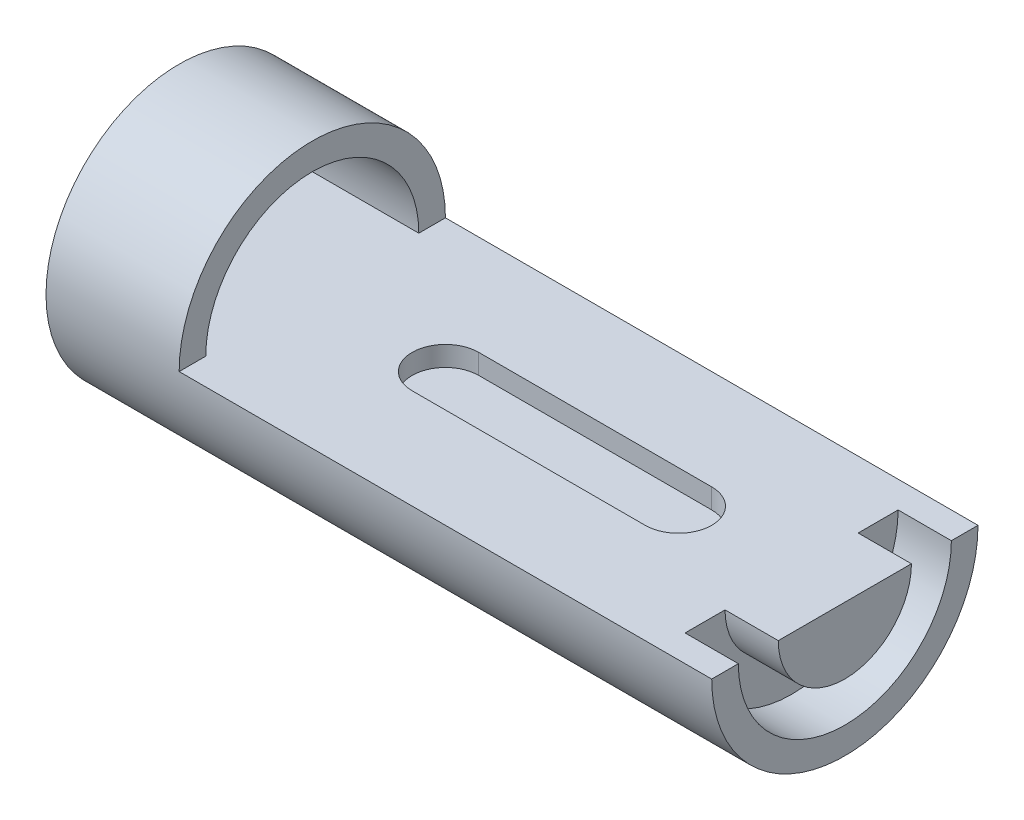
from build123d import *

# Parameters (mm, degrees)
SKETCH1_R           = 20
BOSS_EXTRUDE2_DEPTH = 20
BOSS_EXTRUDE3_START = 72
BOSS_EXTRUDE3_DEPTH = 72
BOSS_EXTRUDE4_START = 80
BOSS_EXTRUDE4_DEPTH = 80
CUT_EXTRUDE1_DEPTH  = 3


with BuildPart() as part:
    # Sketch1 → Boss-Extrude2 (new body)
    with BuildSketch(Plane(origin=(0, 0, 0), x_dir=(0, 0, -1), z_dir=(1, 0, 0))):
        Circle(SKETCH1_R)
        with BuildLine():
            ThreePointArc((-16, 0), (0, 16), (16, 0))
            Line((16, 0), (-16, 0))
        make_face(mode=Mode.SUBTRACT)
    extrude(amount=-BOSS_EXTRUDE2_DEPTH)

    # Sketch1<5> → Boss-Extrude3 (add)
    with BuildSketch(Plane(origin=(0, 0, 0), x_dir=(0, 0, -1), z_dir=(1, 0, 0)).offset(BOSS_EXTRUDE3_START)):
        with BuildLine():
            Line((16, 0), (10, 0))
            ThreePointArc((10, 0), (0, -10), (-10, 0))
            Line((-10, 0), (-16, 0))
            ThreePointArc((-16, 0), (0, -16), (16, 0))
        make_face()
    extrude(amount=-BOSS_EXTRUDE3_DEPTH)

    # Sketch1<6> → Boss-Extrude4 (add)
    with BuildSketch(Plane(origin=(0, 0, 0), x_dir=(0, 0, -1), z_dir=(1, 0, 0)).offset(BOSS_EXTRUDE4_START)):
        with BuildLine():
            ThreePointArc((-10, 0), (0, -10), (10, 0))
            Line((10, 0), (-10, 0))
        make_face()
        with BuildLine():
            Line((20, 0), (16, 0))
            ThreePointArc((16, 0), (0, -16), (-16, 0))
            Line((-16, 0), (-20, 0))
            ThreePointArc((-20, 0), (0, -20), (20, 0))
        make_face()
    extrude(amount=-BOSS_EXTRUDE4_DEPTH)

    # Sketch2 → Cut-Extrude1 (cut)
    with BuildSketch(Plane(origin=(0, 0, 0), x_dir=(1, 0, 0), z_dir=(0, 1, 0))):
        with BuildLine():
            Line((20, 5), (55, 5))
            ThreePointArc((55, 5), (60, 0), (55, -5))
            Line((55, -5), (20, -5))
            ThreePointArc((20, -5), (15, 0), (20, 5))
        make_face()
    extrude(amount=-CUT_EXTRUDE1_DEPTH, mode=Mode.SUBTRACT)


solid = part.part
